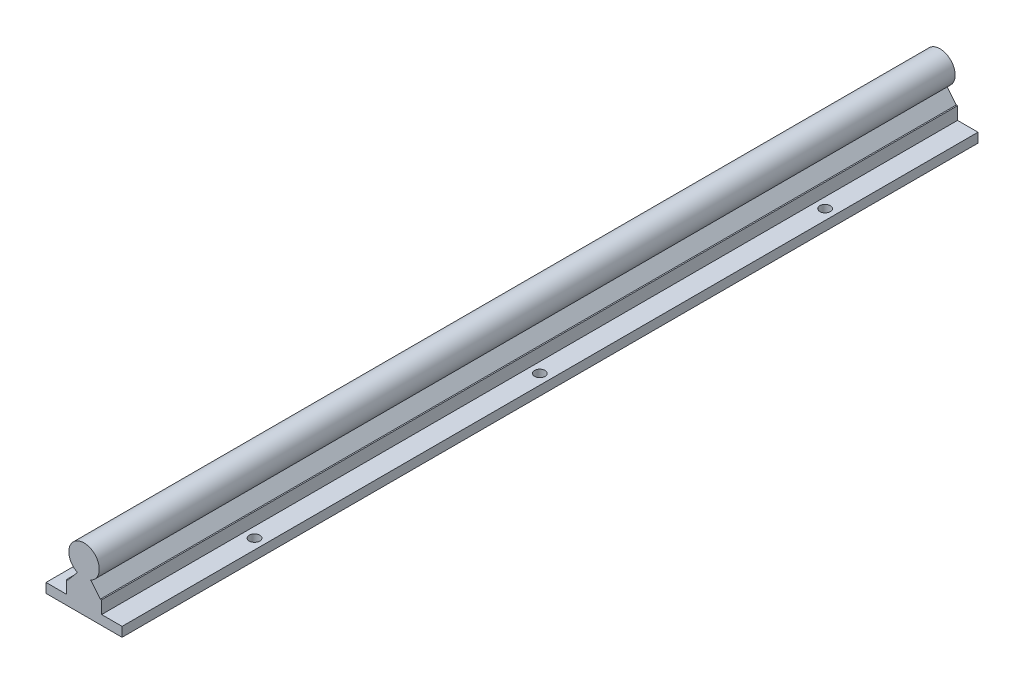
from build123d import *

# Parameters (mm, degrees)
BOSS_EXTRUDE1_DEPTH = 450
SKETCH2_R           = 2.75
CUT_EXTRUDE1_DEPTH  = 450


with BuildPart() as part:
    # Sketch1 → Boss-Extrude1 (new body)
    with BuildSketch(Plane.XY):
        with BuildLine():
            Line((20, 0), (-20, 0))
            Line((-20, 0), (-20, 5))
            Line((-20, 5), (-9.25, 5))
            Line((-9.25, 5), (-9.25, 11.7))
            Line((-9.25, 11.7), (-8.605626905, 11.7))
            Line((-8.605626905, 11.7), (-3.487119155, 17.8))
            ThreePointArc((-3.487119155, 17.8), (0, 33), (3.487119155, 17.8))
            Line((3.487119155, 17.8), (8.605626905, 11.7))
            Line((8.605626905, 11.7), (9.25, 11.7))
            Line((9.25, 11.7), (9.25, 5))
            Line((9.25, 5), (20, 5))
            Line((20, 5), (20, 0))
        make_face()
    extrude(amount=BOSS_EXTRUDE1_DEPTH)

    # Sketch2 → Cut-Extrude1 (cut)
    with BuildSketch(Plane(origin=(0, 0, 0), x_dir=(1, 0, 0), z_dir=(0, 1, 0))):
        with Locations((-14.625, -75)):
            Circle(SKETCH2_R)
        with Locations(Location((14.625, -75, 0), (0, 0, 90))):
            Circle(SKETCH2_R)
        with Locations((-14.625, -225)):
            Circle(SKETCH2_R)
        with Locations(Location((14.625, -225, 0), (0, 0, 90))):
            Circle(SKETCH2_R)
        with Locations((-14.625, -375)):
            Circle(SKETCH2_R)
        with Locations(Location((14.625, -375, 0), (0, 0, 90))):
            Circle(SKETCH2_R)
    extrude(amount=CUT_EXTRUDE1_DEPTH, mode=Mode.SUBTRACT)


solid = part.part
